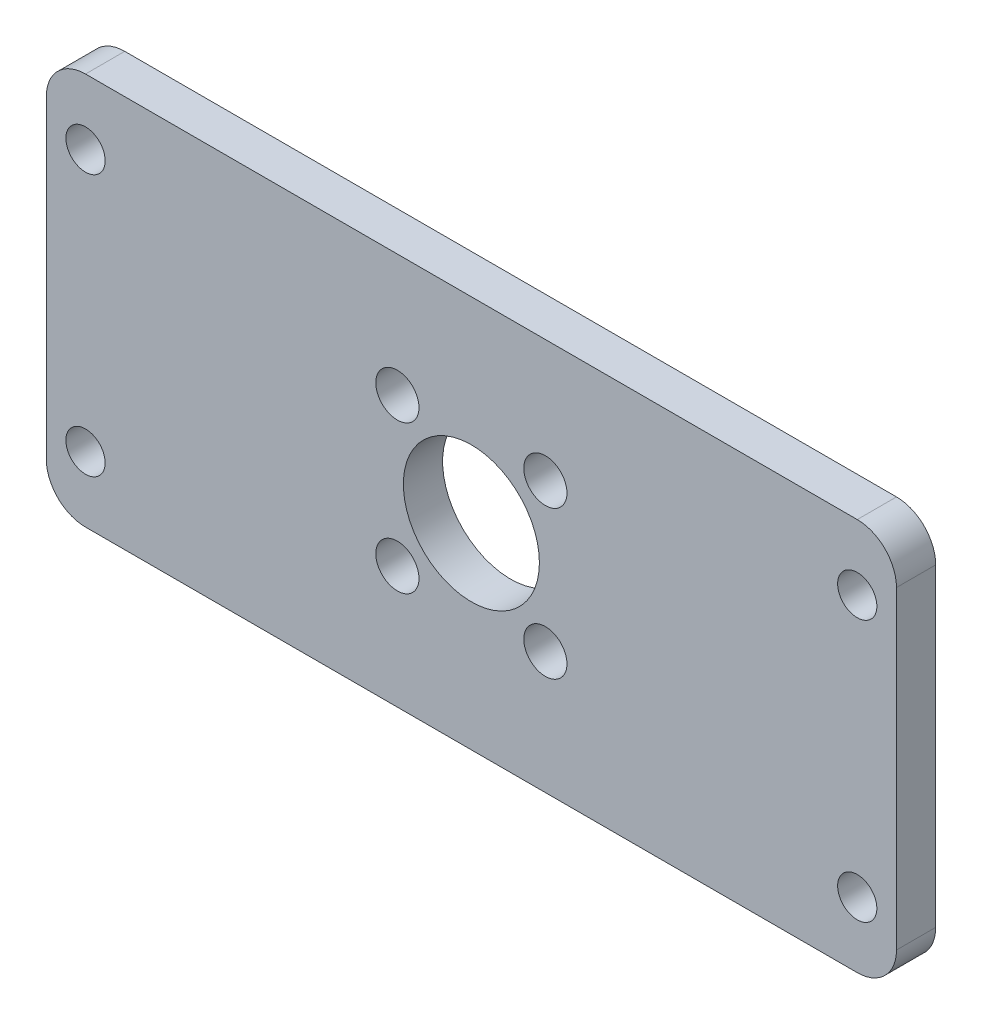
from build123d import *

# Parameters (mm, degrees)
SKETCH_1_W          = 65
SKETCH_1_H          = 40
SKETCH_1_R          = 1.65
SKETCH_1_R_2        = 5.2
EXTRUDE_1_DEPTH     = 3
SKETCH_2_R          = 1.5
CUT_EXTRUDE_1_DEPTH = 3
SKETCH_3_W          = 65
SKETCH_3_H          = 5
CUT_EXTRUDE_2_DEPTH = 10
SKETCH_4_W          = 65
SKETCH_4_H          = 5
CUT_EXTRUDE_3_DEPTH = 10
FILLET_2_R          = 3


with BuildPart() as part:
    # 草图1 → 凸台-拉伸1 (new body)
    with BuildSketch(Plane.XY):
        Rectangle(SKETCH_1_W, SKETCH_1_H)
        with Locations((-5.656854249, 5.656854249)):
            Circle(SKETCH_1_R, mode=Mode.SUBTRACT)
        Circle(SKETCH_1_R_2, mode=Mode.SUBTRACT)
        with Locations((5.656854249, 5.656854249)):
            Circle(SKETCH_1_R, mode=Mode.SUBTRACT)
        with Locations((5.656854249, -5.656854249)):
            Circle(SKETCH_1_R, mode=Mode.SUBTRACT)
        with Locations((-5.656854249, -5.656854249)):
            Circle(SKETCH_1_R, mode=Mode.SUBTRACT)
    extrude(amount=EXTRUDE_1_DEPTH)

    # 草图2 → 切除-拉伸1 (cut)
    with BuildSketch(Plane.XY.offset(3)):
        with Locations((29.5, 10)):
            Circle(SKETCH_2_R)
        with Locations((29.5, -10)):
            Circle(SKETCH_2_R)
        with Locations((-29.5, -10)):
            Circle(SKETCH_2_R)
        with Locations((-29.5, 10)):
            Circle(SKETCH_2_R)
    extrude(amount=-CUT_EXTRUDE_1_DEPTH, mode=Mode.SUBTRACT)

    # 草图3 → 切除-拉伸2 (cut)
    with BuildSketch(Plane(origin=(0, 0, 0), x_dir=(-1, 0, 0), z_dir=(0, 0, -1))):
        with Locations((0, 17.5)):
            Rectangle(SKETCH_3_W, SKETCH_3_H)
    extrude(amount=-CUT_EXTRUDE_2_DEPTH, mode=Mode.SUBTRACT)

    # 草图4 → 切除-拉伸3 (cut)
    with BuildSketch(Plane.XY.offset(3)):
        with Locations((0, -17.5)):
            Rectangle(SKETCH_4_W, SKETCH_4_H)
    extrude(amount=-CUT_EXTRUDE_3_DEPTH, mode=Mode.SUBTRACT)

    # 圆角2
    fillet_2_edges = [part.edges().sort_by_distance(p)[0] for p in [
        (-32.5, 15, 1.5),
        (32.5, 15, 1.5),
        (-32.5, -15, 1.5),
        (32.5, -15, 1.5),
    ]]
    fillet(fillet_2_edges, radius=FILLET_2_R)


solid = part.part
